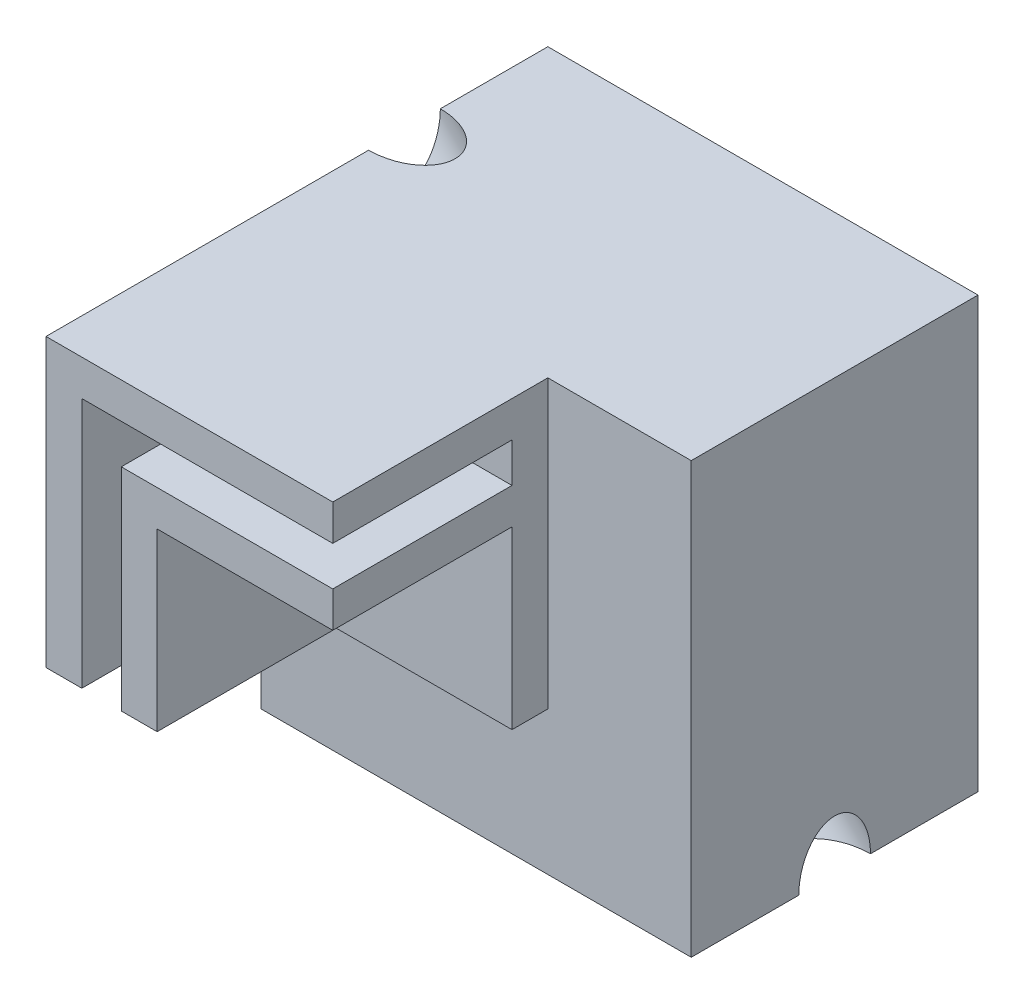
from build123d import *

# Parameters (mm, degrees)
SALIENTE_EXTRUIR1_DEPTH    = 30
CORTAR_EXTRUIR1_DEPTH      = 25
CROQUIS4_W                 = 24.5
CROQUIS4_H                 = 24.5
SALIENTE_EXTRUIR2_DEPTH    = 5
CROQUIS5_W                 = 40
CROQUIS5_H                 = 40
CROQUIS5_W_2               = 20
SALIENTE_EXTRUIR4_DEPTH    = 40
CORTAR_EXTRUIR5_DEPTH      = 59.309518948
CORTAR_EXTRUIR5_DEPTH_BACK = 59.309518948
CROQUIS9_R                 = 5


with BuildPart() as part:
    # Croquis1 → Saliente-Extruir1 (new body)
    with BuildSketch(Plane.XY):
        Polygon((-5, 5), (35, 5), (35, -10.5), (10.5, -10.5), (10.5, -35), (-5, -35), align=None)
    extrude(amount=SALIENTE_EXTRUIR1_DEPTH)

    # Croquis3 → Cortar-Extruir1 (cut)
    with BuildSketch(Plane.XY.offset(30)):
        Polygon((0, -30), (0, -35), (5.5, -35), (5.5, -30), (5.5, -5.5), (30, -5.5), (35, -5.5), (35, 0), (30, 0), (0, 0), align=None)
    extrude(amount=-CORTAR_EXTRUIR1_DEPTH, mode=Mode.SUBTRACT)

    # Croquis4 → Saliente-Extruir2 (add)
    with BuildSketch(Plane(origin=(0, 0, 0), x_dir=(-1, 0, 0), z_dir=(0, 0, -1))):
        with Locations((-22.75, -22.75)):
            Rectangle(CROQUIS4_W, CROQUIS4_H)
    extrude(amount=-SALIENTE_EXTRUIR2_DEPTH)

    # Croquis5 → Saliente-Extruir4 (add)
    with BuildSketch(Plane(origin=(0, 0, 0), x_dir=(-1, 0, 0), z_dir=(0, 0, -1))):
        with Locations((-15, -15)):
            Rectangle(CROQUIS5_W, CROQUIS5_H)
        with Locations((-45, -15)):
            Rectangle(CROQUIS5_W_2, CROQUIS5_H)
        Polygon((5, -55), (5, -35), (-35, -35), (-55, -35), (-55, -55), align=None)
    extrude(amount=SALIENTE_EXTRUIR4_DEPTH)

    # Croquis9 → Cortar-Extruir5 (cut, two sides: drawn at the far end of the back side and taken through both)
    with BuildSketch(Plane(origin=(25, -25, 0), x_dir=(0, 0, 1), z_dir=(0.7071067811865487, -0.7071067811865465, 0)).offset(-CORTAR_EXTRUIR5_DEPTH_BACK)):
        with Locations(Location((-20, 0, 0), (0, 0, 180))):
            Circle(CROQUIS9_R)
    extrude(amount=CORTAR_EXTRUIR5_DEPTH + CORTAR_EXTRUIR5_DEPTH_BACK, mode=Mode.SUBTRACT)


solid = part.part
